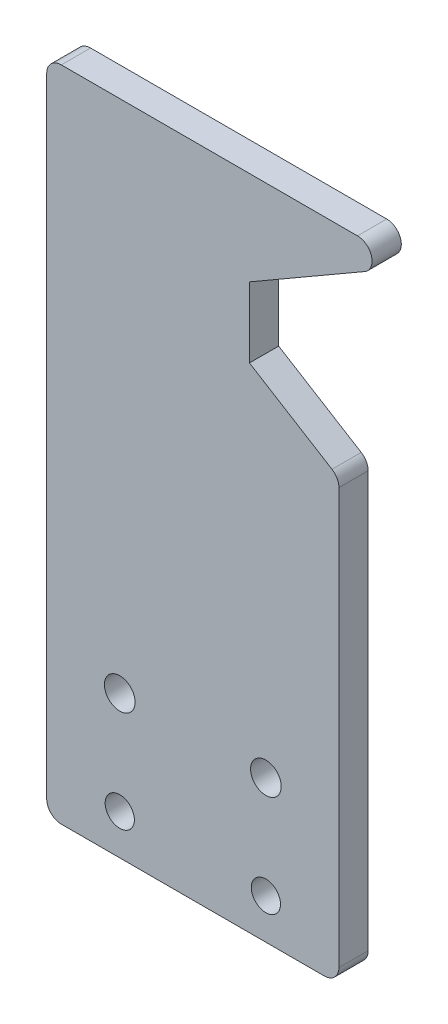
from build123d import *

# Parameters (mm, degrees)
EXTRUDE_1_DEPTH     = 4
CUT_EXTRUDE_1_REACH = 66.946
SKETCH_2_R          = 2
SKETCH_2_R_2        = 2.1
FILLET_1_R          = 2


with BuildPart() as part:
    # 草图1 → 凸台-拉伸1 (new body)
    with BuildSketch(Plane.XY):
        with BuildLine():
            Line((22.535898385, 60), (-20, 60))
            Line((-20, 60), (-20, 30))
            Line((-20, 30), (-20, -30))
            Line((-20, -30), (20, -30))
            Line((20, -30), (20, 30))
            Line((20, 30), (7.749348907, 37.54075723))
            Line((7.749348907, 37.54075723), (7.749348907, 47.153580602))
            Line((7.749348907, 47.153580602), (23.535898385, 56.267949192))
            ThreePointArc((23.535898385, 56.267949192), (24.467750037, 58.51763809), (22.535898385, 60))
        make_face()
    extrude(amount=EXTRUDE_1_DEPTH)

    # 草图2 → 切除-拉伸1 (cut, up to next)
    with BuildSketch(Plane.XY.offset(4), mode=Mode.PRIVATE) as cut_extrude_1_sk1:
        with Locations((-10, -24.5)):
            Circle(SKETCH_2_R)
    cut_extrude_1_tool1 = extrude(cut_extrude_1_sk1.sketch, amount=-CUT_EXTRUDE_1_REACH, mode=Mode.PRIVATE) & part.part
    # 草图2 → 切除-拉伸1 (cut, up to next)
    with BuildSketch(Plane.XY.offset(4), mode=Mode.PRIVATE) as cut_extrude_1_sk2:
        with Locations((-10, -10.5)):
            Circle(SKETCH_2_R_2)
    cut_extrude_1_tool2 = extrude(cut_extrude_1_sk2.sketch, amount=-CUT_EXTRUDE_1_REACH, mode=Mode.PRIVATE) & part.part
    # 草图2 → 切除-拉伸1 (cut, up to next)
    with BuildSketch(Plane.XY.offset(4), mode=Mode.PRIVATE) as cut_extrude_1_sk3:
        with Locations((10, -10.5)):
            Circle(SKETCH_2_R_2)
    cut_extrude_1_tool3 = extrude(cut_extrude_1_sk3.sketch, amount=-CUT_EXTRUDE_1_REACH, mode=Mode.PRIVATE) & part.part
    # 草图2 → 切除-拉伸1 (cut, up to next)
    with BuildSketch(Plane.XY.offset(4), mode=Mode.PRIVATE) as cut_extrude_1_sk4:
        with Locations((10, -24.5)):
            Circle(SKETCH_2_R)
    cut_extrude_1_tool4 = extrude(cut_extrude_1_sk4.sketch, amount=-CUT_EXTRUDE_1_REACH, mode=Mode.PRIVATE) & part.part
    add(cut_extrude_1_tool1.solids().sort_by_distance((-10, -24.5, 4))[0], mode=Mode.SUBTRACT)
    add(cut_extrude_1_tool2.solids().sort_by_distance((-10, -10.5, 4))[0], mode=Mode.SUBTRACT)
    add(cut_extrude_1_tool3.solids().sort_by_distance((10, -10.5, 4))[0], mode=Mode.SUBTRACT)
    add(cut_extrude_1_tool4.solids().sort_by_distance((10, -24.5, 4))[0], mode=Mode.SUBTRACT)

    # 圆角1
    fillet_1_edges = [part.edges().sort_by_distance(p)[0] for p in [
        (20, 30, 2),
        (20, -30, 2),
        (-20, -30, 2),
        (-20, 60, 2),
    ]]
    fillet(fillet_1_edges, radius=FILLET_1_R)


solid = part.part
